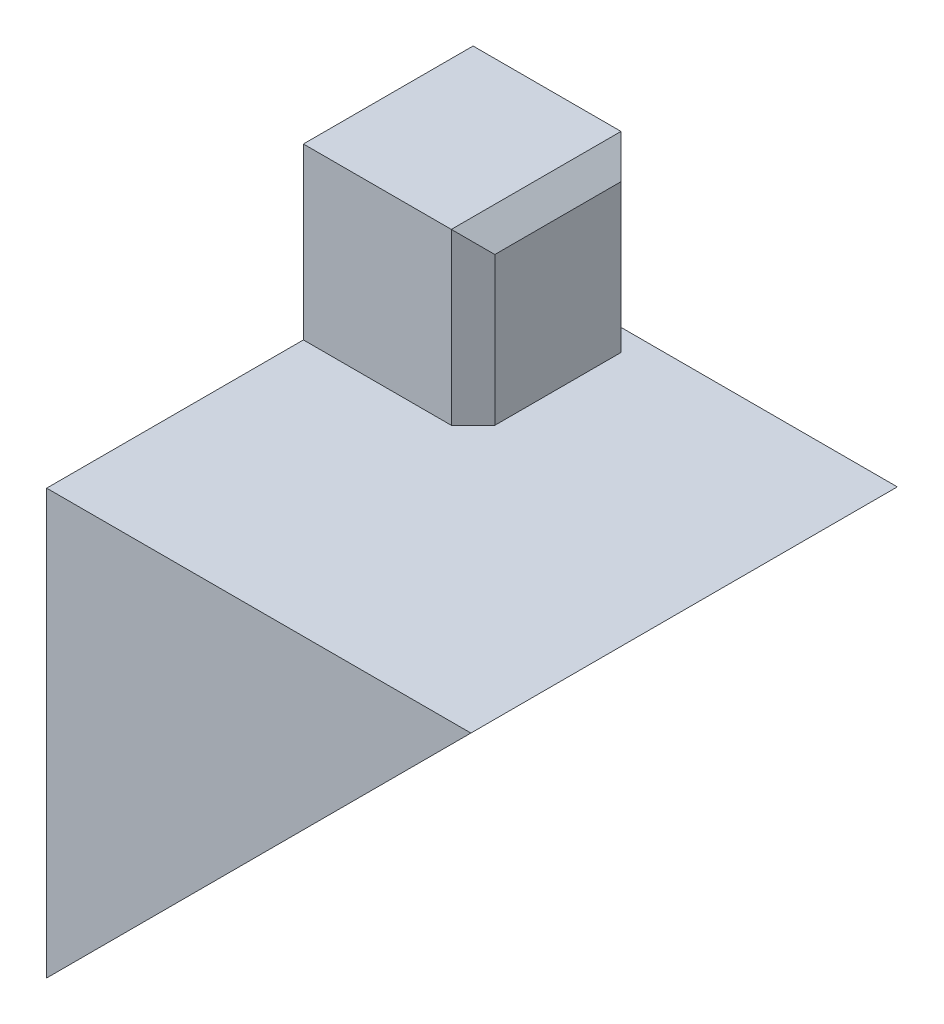
from build123d import *

# Parameters (mm, degrees)
BOSS_EXTRUDE1_DEPTH = 19.6
BOSS_EXTRUDE4_DEPTH = 7.8
CHAMFER3_SIZE       = 1


with BuildPart() as part:
    # Sketch1 → Boss-Extrude1 (new body)
    with BuildSketch(Plane.XY):
        Polygon((0, 0), (0, -19.5), (19.5, 0), align=None)
    extrude(amount=-BOSS_EXTRUDE1_DEPTH)

    # Sketch2 → Boss-Extrude4 (add)
    with BuildSketch(Plane(origin=(0, 0, 0), x_dir=(1, 0, 0), z_dir=(0, 1, 0))):
        Polygon((7.8, 19.6), (0, 19.6), (0, 13.7), (0, 11.8), (7.8, 11.8), align=None)
    extrude(amount=BOSS_EXTRUDE4_DEPTH)

    # Chamfer3
    chamfer3_edges = [part.edges().sort_by_distance(p)[0] for p in [
        (7.8, 3.9, -11.8),
        (7.8, 3.9, -19.6),
        (7.8, 7.8, -15.7),
    ]]
    chamfer(chamfer3_edges, length=CHAMFER3_SIZE)


solid = part.part
